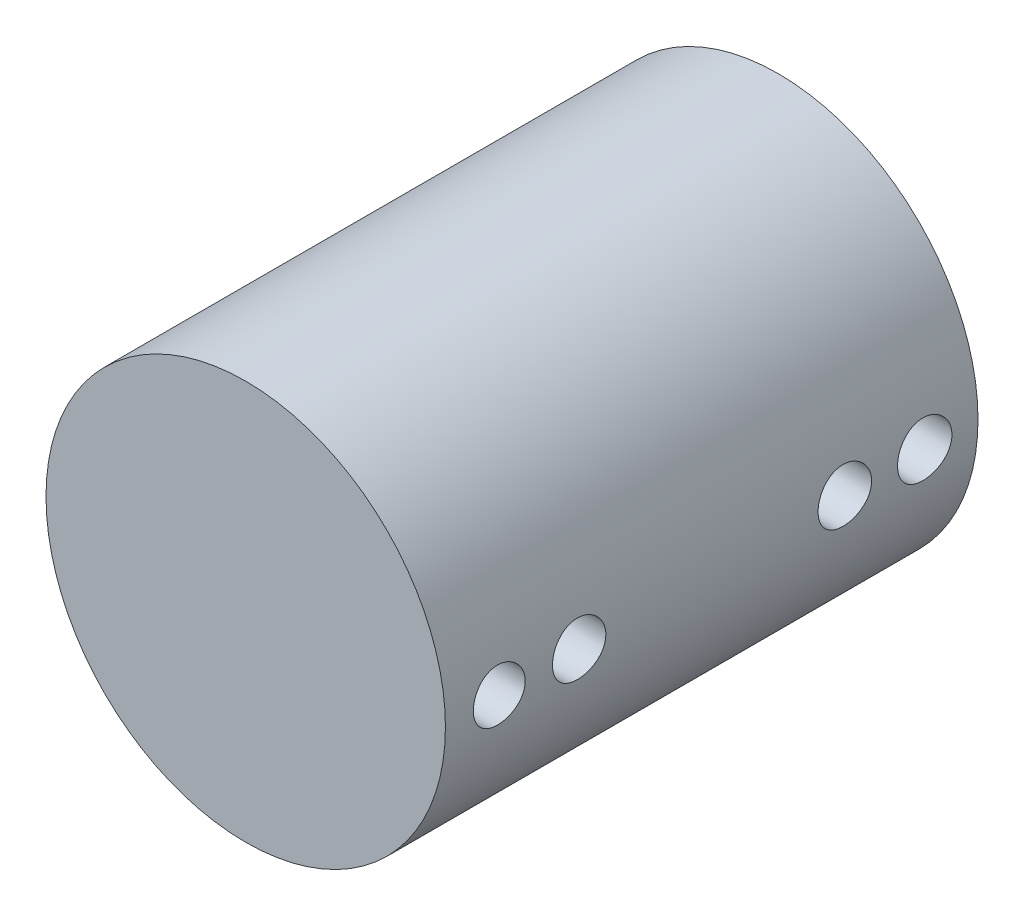
from build123d import *

# Parameters (mm, degrees)
SKETCH2_R           = 19.05
BOSS_EXTRUDE1_DEPTH = 50.8
SKETCH3_R           = 2.593311049
SKETCH3_R_2         = 2.552831608
SKETCH3_R_3         = 2.477244579
SKETCH3_R_4         = 2.54595384
CUT_EXTRUDE1_DEPTH  = 67.295946332


with BuildPart() as part:
    # Sketch2 → Boss-Extrude1 (new body)
    with BuildSketch(Plane.XY):
        Circle(SKETCH2_R)
    extrude(amount=BOSS_EXTRUDE1_DEPTH)

    # Sketch3 → Cut-Extrude1 (cut, through all)
    with BuildSketch(Plane.ZY.offset(19.05)):
        with Locations((5.08, 0)):
            Circle(SKETCH3_R)
        with Locations((12.7, 0)):
            Circle(SKETCH3_R_2)
        with Locations((45.663499475, 0)):
            Circle(SKETCH3_R_3)
        with Locations((38.043499475, 0)):
            Circle(SKETCH3_R_4)
    extrude(amount=-CUT_EXTRUDE1_DEPTH, mode=Mode.SUBTRACT)


solid = part.part
